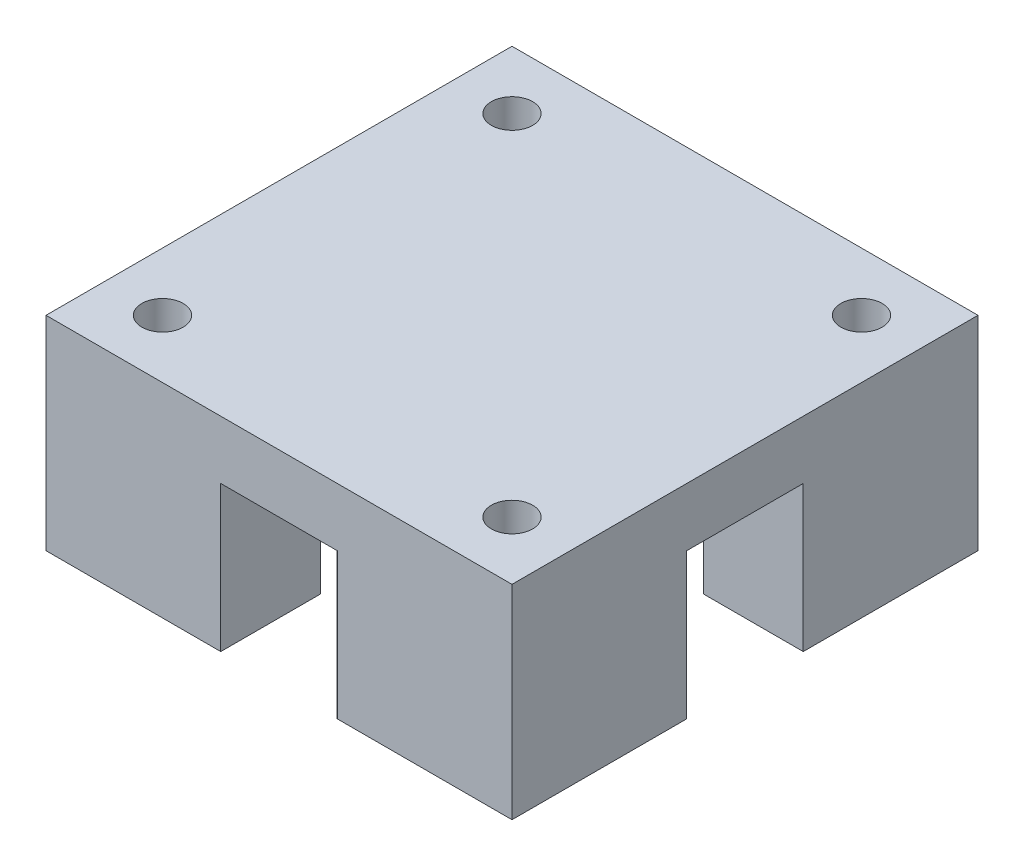
from build123d import *

# Parameters (mm, degrees)
SKETCH1_W             = 50.8
SKETCH1_H             = 50.8
BOSS_EXTRUDE1_DEPTH   = 22.225
F_8_CLEARANCE_HOLE1_D = 4.4958
SKETCH9_W             = 12.7
SKETCH9_H             = 12.7
CUT_EXTRUDE1_DEPTH    = 15.875


with BuildPart() as part:
    # Sketch1 → Boss-Extrude1 (new body)
    with BuildSketch(Plane(origin=(0, 0, 0), x_dir=(1, 0, 0), z_dir=(0, 1, 0))):
        Rectangle(SKETCH1_W, SKETCH1_H)
    extrude(amount=BOSS_EXTRUDE1_DEPTH)

    # #8 Clearance Hole1 (through all)
    with Locations(Plane(origin=(0, 22.225, 0), x_dir=(1, 0, 0), z_dir=(0, 1, 0))):
        with Locations((-19.05, 19.05), (19.05, 19.05), (19.05, -19.05), (-19.05, -19.05)):
            Hole(F_8_CLEARANCE_HOLE1_D / 2)

    # Sketch9 → Cut-Extrude1 (cut)
    with BuildSketch(Plane.XZ):
        with BuildLine():
            ThreePointArc((-6.35, 14.549677831), (-11.225320151, 11.225320151), (-14.549677831, 6.35))
            Line((-14.549677831, 6.35), (-6.35, 6.35))
            Line((-6.35, 6.35), (-6.35, 14.549677831))
        make_face()
        with BuildLine():
            Line((-6.35, 25.4), (-6.35, 14.549677831))
            ThreePointArc((-6.35, 14.549677831), (0, 15.875), (6.35, 14.549677831))
            Line((6.35, 14.549677831), (6.35, 25.4))
            Line((6.35, 25.4), (-6.35, 25.4))
        make_face()
        with BuildLine():
            Line((6.35, 14.549677831), (6.35, 6.35))
            Line((6.35, 6.35), (14.549677831, 6.35))
            ThreePointArc((14.549677831, 6.35), (11.225320151, 11.225320151), (6.35, 14.549677831))
        make_face()
        with BuildLine():
            Line((25.4, 6.35), (14.549677831, 6.35))
            ThreePointArc((14.549677831, 6.35), (15.540137718, 3.243415594), (15.875, 0))
            ThreePointArc((15.875, 0), (15.540137718, -3.243415594), (14.549677831, -6.35))
            Line((14.549677831, -6.35), (25.4, -6.35))
            Line((25.4, -6.35), (25.4, 6.35))
        make_face()
        with BuildLine():
            Line((14.549677831, -6.35), (6.35, -6.35))
            Line((6.35, -6.35), (6.35, -14.549677831))
            ThreePointArc((6.35, -14.549677831), (11.225320151, -11.225320151), (14.549677831, -6.35))
        make_face()
        with BuildLine():
            ThreePointArc((6.35, -14.549677831), (0, -15.875), (-6.35, -14.549677831))
            Line((-6.35, -14.549677831), (-6.35, -25.4))
            Line((-6.35, -25.4), (6.35, -25.4))
            Line((6.35, -25.4), (6.35, -14.549677831))
        make_face()
        with BuildLine():
            Line((-6.35, -6.35), (-14.549677831, -6.35))
            ThreePointArc((-14.549677831, -6.35), (-11.225320151, -11.225320151), (-6.35, -14.549677831))
            Line((-6.35, -14.549677831), (-6.35, -6.35))
        make_face()
        with BuildLine():
            Line((-14.549677831, 6.35), (-25.4, 6.35))
            Line((-25.4, 6.35), (-25.4, -6.35))
            Line((-25.4, -6.35), (-14.549677831, -6.35))
            ThreePointArc((-14.549677831, -6.35), (-15.875, 0), (-14.549677831, 6.35))
        make_face()
        with BuildLine():
            Line((-6.35, 6.35), (-14.549677831, 6.35))
            ThreePointArc((-14.549677831, 6.35), (-15.875, 0), (-14.549677831, -6.35))
            Line((-14.549677831, -6.35), (-6.35, -6.35))
            Line((-6.35, -6.35), (-6.35, 6.35))
        make_face()
        with BuildLine():
            Line((6.35, -6.35), (-6.35, -6.35))
            Line((-6.35, -6.35), (-6.35, -14.549677831))
            ThreePointArc((-6.35, -14.549677831), (0, -15.875), (6.35, -14.549677831))
            Line((6.35, -14.549677831), (6.35, -6.35))
        make_face()
        with BuildLine():
            Line((14.549677831, 6.35), (6.35, 6.35))
            Line((6.35, 6.35), (6.35, -6.35))
            Line((6.35, -6.35), (14.549677831, -6.35))
            ThreePointArc((14.549677831, -6.35), (15.540137718, -3.243415594), (15.875, 0))
            ThreePointArc((15.875, 0), (15.540137718, 3.243415594), (14.549677831, 6.35))
        make_face()
        Rectangle(SKETCH9_W, SKETCH9_H)
        with BuildLine():
            Line((-6.35, 14.549677831), (-6.35, 6.35))
            Line((-6.35, 6.35), (6.35, 6.35))
            Line((6.35, 6.35), (6.35, 14.549677831))
            ThreePointArc((6.35, 14.549677831), (0, 15.875), (-6.35, 14.549677831))
        make_face()
    extrude(amount=-CUT_EXTRUDE1_DEPTH, mode=Mode.SUBTRACT)


solid = part.part
